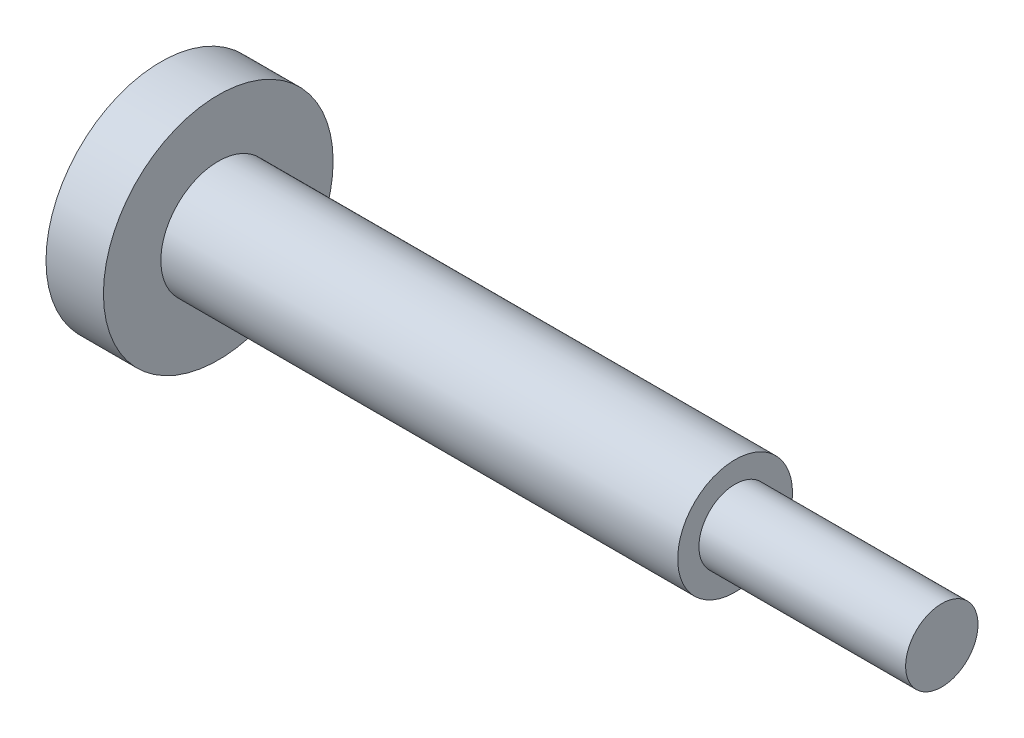
from build123d import *

# Parameters (mm, degrees)
SKETCH1_R           = 2
BOSS_EXTRUDE1_DEPTH = 11.43
SKETCH1_3_R         = 3.175
BOSS_EXTRUDE2_DEPTH = 28.575
SKETCH2_R           = 6.35
BOSS_EXTRUDE3_DEPTH = 3.175


with BuildPart() as part:
    # Sketch1 → Boss-Extrude1 (new body)
    with BuildSketch(Plane(origin=(0, 0, 0), x_dir=(0, 0, -1), z_dir=(1, 0, 0))):
        Circle(SKETCH1_R)
    extrude(amount=BOSS_EXTRUDE1_DEPTH)

    # Sketch1<3> → Boss-Extrude2 (add)
    with BuildSketch(Plane(origin=(0, 0, 0), x_dir=(0, 0, -1), z_dir=(1, 0, 0))):
        Circle(SKETCH1_3_R)
    extrude(amount=-BOSS_EXTRUDE2_DEPTH)

    # Sketch2 → Boss-Extrude3 (add)
    with BuildSketch(Plane.ZY.offset(28.575)):
        Circle(SKETCH2_R)
    extrude(amount=BOSS_EXTRUDE3_DEPTH)


solid = part.part
